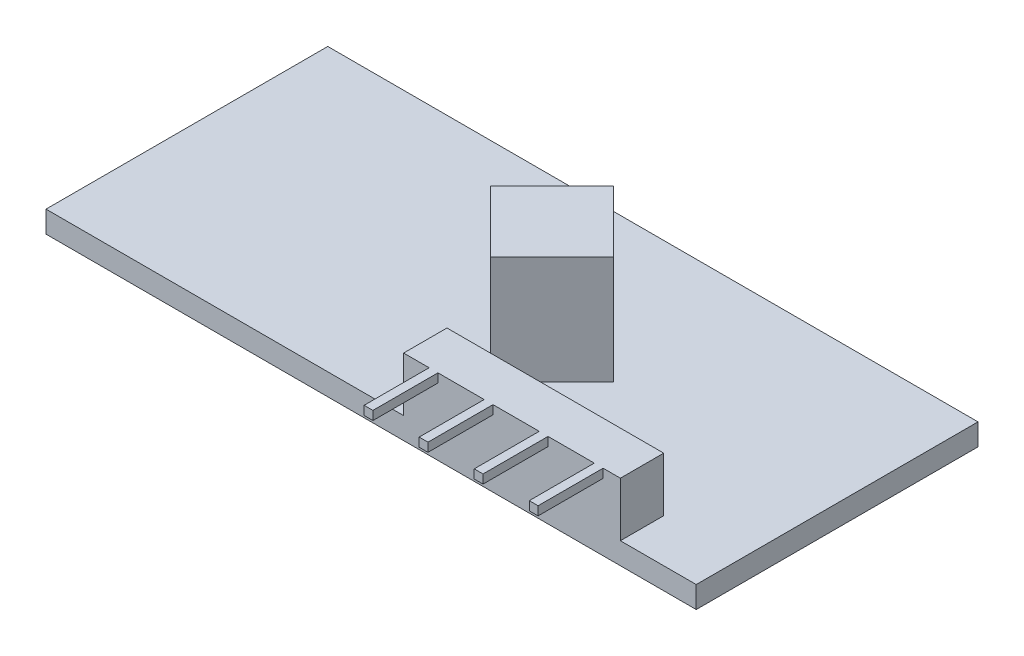
from build123d import *

# Parameters (mm, degrees)
SKETCH1_W           = 30
SKETCH1_H           = 13
BOSS_EXTRUDE1_DEPTH = 1
SKETCH2_W           = 10
SKETCH2_H           = 2
BOSS_EXTRUDE2_DEPTH = 2.5
SKETCH4_W           = 0.4064
SKETCH4_H           = 0.4064
BOSS_EXTRUDE3_DEPTH = 3
LPATTERN1_COUNT     = 4
LPATTERN1_PITCH     = 2.54
BOSS_EXTRUDE4_DEPTH = 5


with BuildPart() as part:
    # Sketch1 → Boss-Extrude1 (new body)
    with BuildSketch(Plane(origin=(0, 0, 0), x_dir=(1, 0, 0), z_dir=(0, 1, 0))):
        Rectangle(SKETCH1_W, SKETCH1_H)
    extrude(amount=BOSS_EXTRUDE1_DEPTH)

    # Sketch2 → Boss-Extrude2 (add)
    with BuildSketch(Plane(origin=(0, 1, 0), x_dir=(1, 0, 0), z_dir=(0, 1, 0))):
        with Locations((6.5, -5.5)):
            Rectangle(SKETCH2_W, SKETCH2_H)
    extrude(amount=BOSS_EXTRUDE2_DEPTH)

    # Sketch4 → Boss-Extrude3 (add)
    with BuildSketch(Plane.XY.offset(6.5)):
        with Locations((10.5, 3.2968)):
            Rectangle(SKETCH4_W, SKETCH4_H)
    boss_extrude3 = extrude(amount=BOSS_EXTRUDE3_DEPTH)

    # LPattern1: Boss-Extrude3 ×4
    with Locations(*[(-i * LPATTERN1_PITCH, 0, 0) for i in range(1, LPATTERN1_COUNT)]):
        add(boss_extrude3)

    # Sketch5 → Boss-Extrude4 (add)
    with BuildSketch(Plane(origin=(0, 1, 0), x_dir=(1, 0, 0), z_dir=(0, 1, 0))):
        Polygon((-0.656854249, -0.328427125), (2.171572875, -3.156854249), (5, -0.328427125), (2.171572875, 2.5), align=None)
    extrude(amount=BOSS_EXTRUDE4_DEPTH)


solid = part.part
